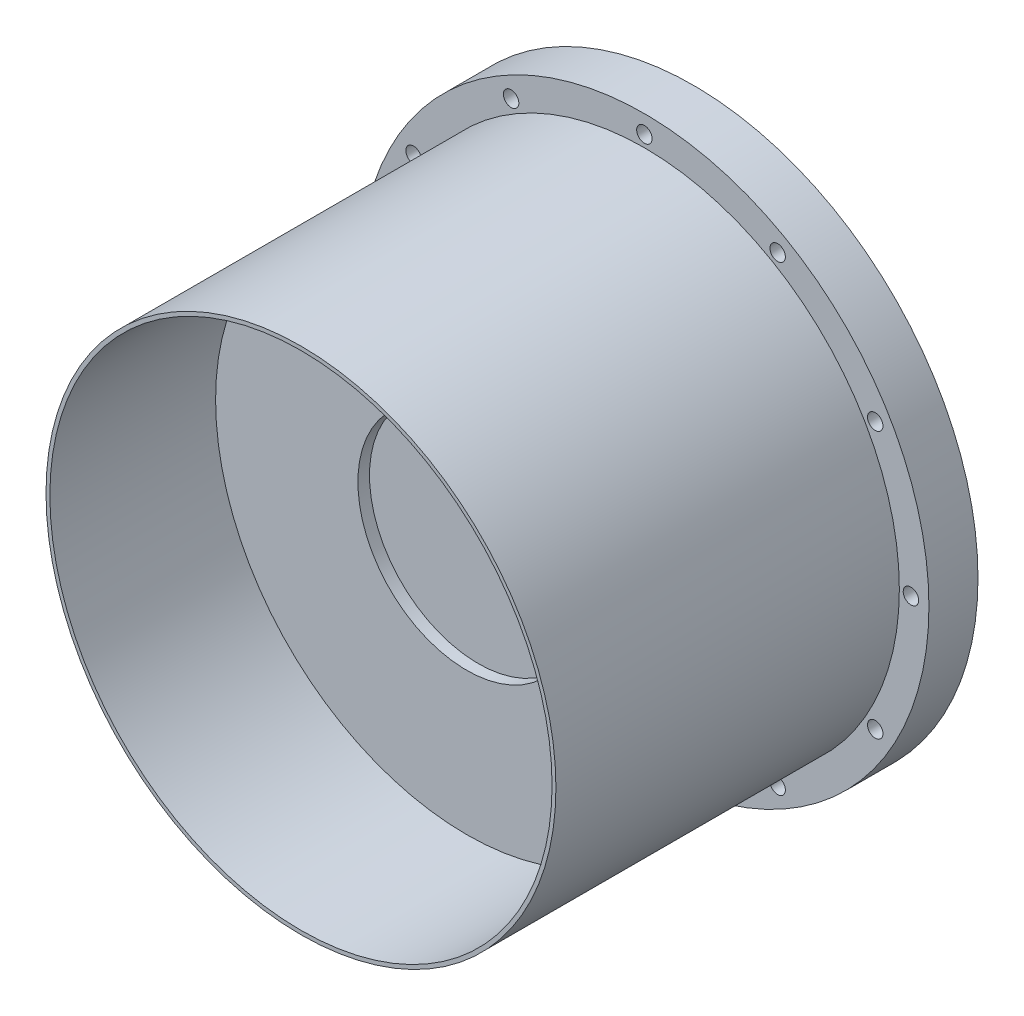
from build123d import *

# Parameters (mm, degrees)
SKETCH1_R           = 73.66
BOSS_EXTRUDE1_DEPTH = 12.7
SKETCH2_R           = 2
CUT_EXTRUDE1_DEPTH  = 12.7
SKETCH3_R           = 66
SKETCH3_R_2         = 65
BOSS_EXTRUDE2_DEPTH = 88.9
SKETCH4_R           = 65
SKETCH4_R_2         = 28.162552898
BOSS_EXTRUDE3_DEPTH = 3
SKETCH5_R           = 65
SKETCH5_R_2         = 28.162552898
BOSS_EXTRUDE4_DEPTH = 3
CUT_EXTRUDE2_START  = -300
SKETCH6_R           = 28.162552898
CUT_EXTRUDE2_DEPTH  = 300


with BuildPart() as part:
    # Sketch1 → Boss-Extrude1 (new body)
    with BuildSketch(Plane.XY):
        Circle(SKETCH1_R)
    extrude(amount=BOSS_EXTRUDE1_DEPTH)

    # Sketch2 → Cut-Extrude1 (cut)
    with BuildSketch(Plane.XY.offset(12.7)):
        with Locations((0, 69)):
            Circle(SKETCH2_R)
        with Locations((34.5, 59.755752861)):
            Circle(SKETCH2_R)
        with Locations((59.755752861, 34.5)):
            Circle(SKETCH2_R)
        with Locations((69, 0)):
            Circle(SKETCH2_R)
        with Locations((59.755752861, -34.5)):
            Circle(SKETCH2_R)
        with Locations((34.5, -59.755752861)):
            Circle(SKETCH2_R)
        with Locations((0, -69)):
            Circle(SKETCH2_R)
        with Locations((-34.5, -59.755752861)):
            Circle(SKETCH2_R)
        with Locations((-59.755752861, -34.5)):
            Circle(SKETCH2_R)
        with Locations((-69, 0)):
            Circle(SKETCH2_R)
        with Locations((-59.755752861, 34.5)):
            Circle(SKETCH2_R)
        with Locations((-34.5, 59.755752861)):
            Circle(SKETCH2_R)
    extrude(amount=-CUT_EXTRUDE1_DEPTH, mode=Mode.SUBTRACT)

    # Sketch3 → Boss-Extrude2 (add)
    with BuildSketch(Plane.XY.offset(12.7)):
        Circle(SKETCH3_R)
        Circle(SKETCH3_R_2, mode=Mode.SUBTRACT)
    extrude(amount=BOSS_EXTRUDE2_DEPTH)

    # Sketch4 → Boss-Extrude3 (add)
    with BuildSketch(Plane.XY.offset(32.7)):
        Circle(SKETCH4_R)
        Circle(SKETCH4_R_2, mode=Mode.SUBTRACT)
    extrude(amount=BOSS_EXTRUDE3_DEPTH)

    # Sketch5 → Boss-Extrude4 (add)
    with BuildSketch(Plane.XY.offset(55.7)):
        Circle(SKETCH5_R)
        Circle(SKETCH5_R_2, mode=Mode.SUBTRACT)
    extrude(amount=BOSS_EXTRUDE4_DEPTH)

    # Sketch6 → Cut-Extrude2 (cut)
    with BuildSketch(Plane.XY.offset(12.7).offset(CUT_EXTRUDE2_START)):
        Circle(SKETCH6_R)
    extrude(amount=CUT_EXTRUDE2_DEPTH, mode=Mode.SUBTRACT)


solid = part.part
